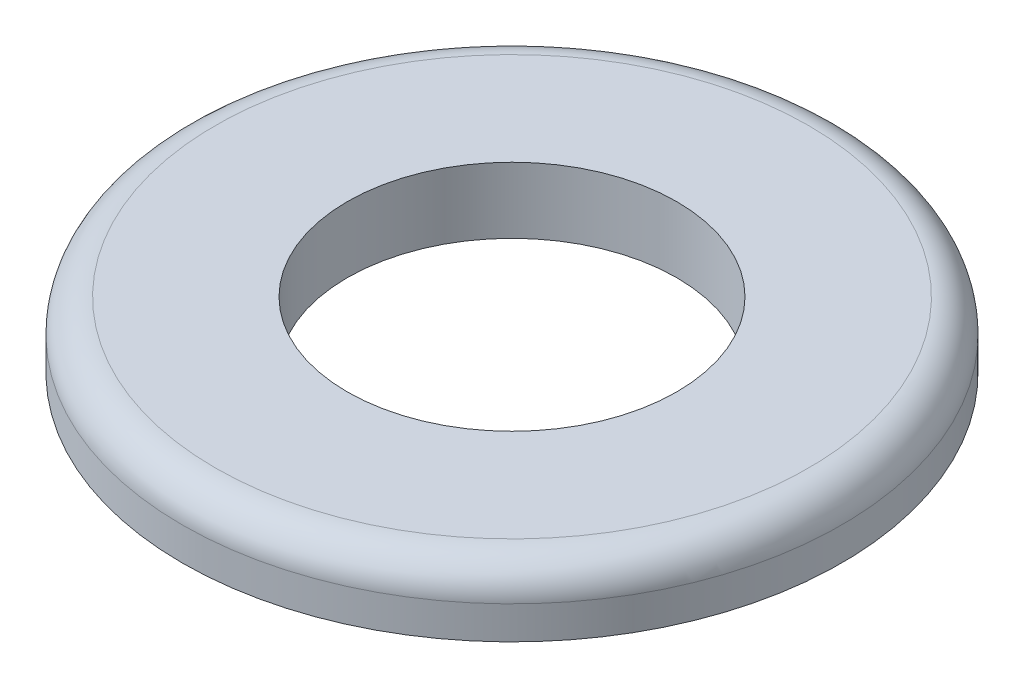
from build123d import *

# Parameters (mm, degrees)
SKETCH_1_R      = 5
SKETCH_1_R_2    = 2.5
EXTRUDE_1_DEPTH = 1
FILLET_1_R      = 0.5


with BuildPart() as part:
    # 草图1 → 凸台-拉伸1 (new body)
    with BuildSketch(Plane(origin=(0, 0, 0), x_dir=(1, 0, 0), z_dir=(0, 1, 0))):
        with Locations(Location((0, 0, 0), (0, 0, 270))):
            Circle(SKETCH_1_R)
        with Locations(Location((0, 0, 0), (0, 0, 270))):
            Circle(SKETCH_1_R_2, mode=Mode.SUBTRACT)
    extrude(amount=EXTRUDE_1_DEPTH)

    # 圆角1
    fillet_1_edges = [part.edges().sort_by_distance(p)[0] for p in [
        (0, 1, -5),
    ]]
    fillet(fillet_1_edges, radius=FILLET_1_R)


solid = part.part
